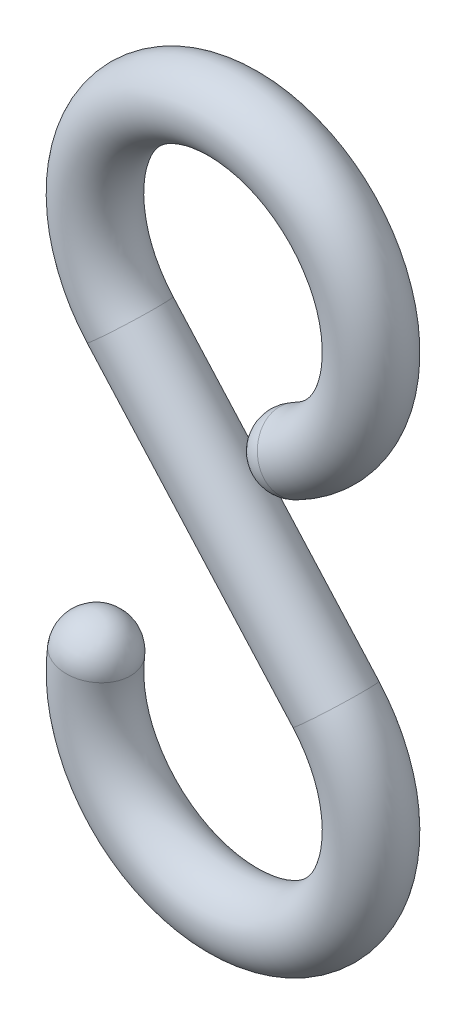
from build123d import *

# Parameters (mm, degrees)
SWEEP2_PROFILE_R  = 3.175
DOME1_FACE_RADIUS = 3.175
DOME1_HEIGHT      = 3.175
DOME3_FACE_RADIUS = 3.175
DOME3_HEIGHT      = 3.175


with BuildPart() as part:
    # Sweep2: sweep along a path in Sketch2
    with BuildLine(Plane.XY) as sweep2_path:
        ThreePointArc((-12.585861744, 1.698847895), (3.726150042, -12.141079271), (9.466021105, 8.466666667))
        Line((9.466021105, 8.466666667), (-9.466021105, 29.633333333))
        ThreePointArc((-9.466021105, 29.633333333), (2.360327397, 50.578736097), (5.719812954, 26.760963896))
    # Sweep2 profile (on start of the path) → Sweep2 (sweep)
    with BuildSketch(Plane(origin=(-12.585861744, 1.698847895, 0), x_dir=(-0.9910127357206825, 0.1337675507715111, 0), z_dir=(-0.1337675507715111, -0.9910127357206825, 0))):
        Circle(SWEEP2_PROFILE_R)
    sweep(path=sweep2_path.line)

    # Dome1: a dome of height H over a round flat face of radius A is a cap of a sphere of radius (A * A + H * H) / (2 * H)
    dome1_r = (DOME1_FACE_RADIUS * DOME1_FACE_RADIUS + DOME1_HEIGHT * DOME1_HEIGHT) / (2 * DOME1_HEIGHT)
    dome1_base = Plane((-12.585861744, 1.698847895, 0), z_dir=(0.133767550772, 0.991012735721, 0))
    with Locations(dome1_base.offset(DOME1_HEIGHT - dome1_r)):
        dome1_ball = Sphere(dome1_r, mode=Mode.PRIVATE)
    add(split(dome1_ball, bisect_by=dome1_base, keep=Keep.TOP, mode=Mode.PRIVATE))

    # Dome3: a dome of height H over a round flat face of radius A is a cap of a sphere of radius (A * A + H * H) / (2 * H)
    dome3_r = (DOME3_FACE_RADIUS * DOME3_FACE_RADIUS + DOME3_HEIGHT * DOME3_HEIGHT) / (2 * DOME3_HEIGHT)
    dome3_base = Plane((5.719812954, 26.760963896, 0), z_dir=(-0.892837488506, -0.450378972775, 0))
    with Locations(dome3_base.offset(DOME3_HEIGHT - dome3_r)):
        dome3_ball = Sphere(dome3_r, mode=Mode.PRIVATE)
    add(split(dome3_ball, bisect_by=dome3_base, keep=Keep.TOP, mode=Mode.PRIVATE))


solid = part.part
